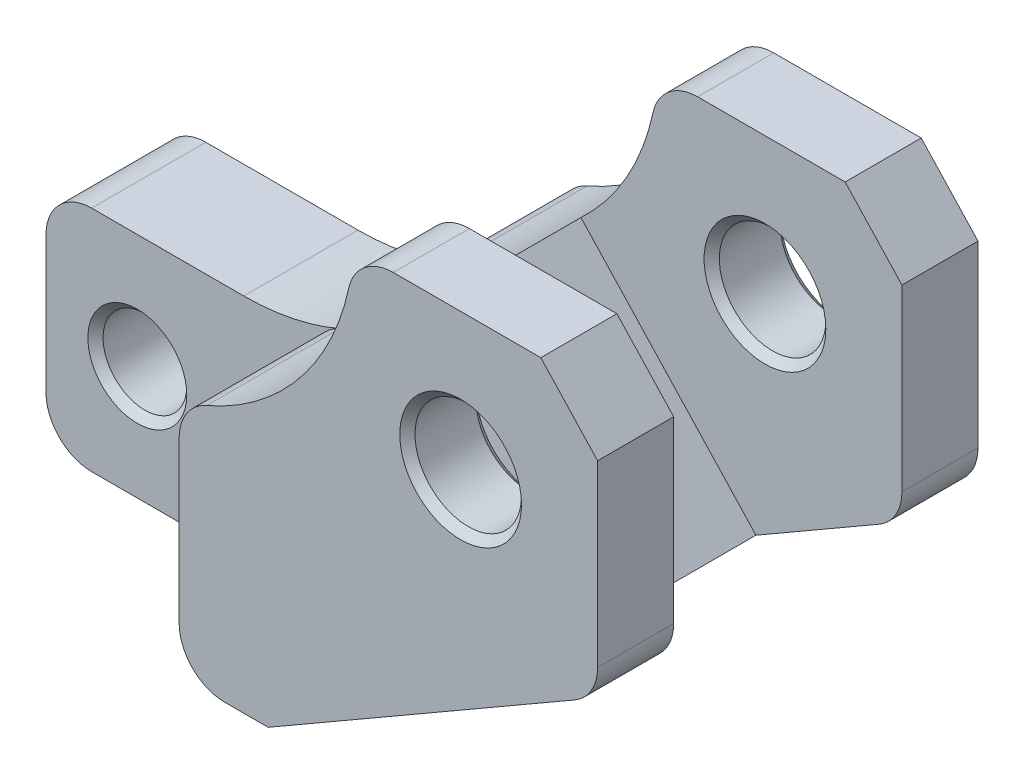
from build123d import *

# Parameters (mm, degrees)
BOSS_EXTRUDE1_DEPTH     = 25000
CHAMFER1_SIZE           = 8000
CHAMFER1_SIZE2          = 7460.120689101317
CUT_EXTRUDE1_DEPTH      = 15000
CUT_EXTRUDE2_DEPTH      = 17500
FILLET1_R               = 6000
CUT_EXTRUDE3_DEPTH      = 112944.56998076734
CUT_EXTRUDE3_DEPTH_BACK = 112944.56998076734
SKETCH6_R               = 5500.000000000001
CUT_EXTRUDE4_DEPTH      = 119164.7528781319
CUT_EXTRUDE4_DEPTH_BACK = 119164.7528781319
SKETCH7_R               = 7000.000000000006
CHAMFER2_SIZE           = 1000
CHAMFER3_SIZE           = 1000
FILLET2_R               = 6000


with BuildPart() as part:
    # Sketch1 → Boss-Extrude1 (new, symmetric)
    with BuildSketch(Plane.XY):
        with BuildLine():
            Line((-6.7599e-13, 23999.999999999956), (-1.69e-13, 6000.000000000043))
            ThreePointArc((-1.69e-13, 6000.000000000043), (1757.3593128807133, 1757.3593128807152), (6000.000000000043, 0))
            Line((6000.000000000043, 0), (46698.72981077821, 0))
            Line((46698.72981077821, 0), (86999.99999999999, 23267.949192431108))
            ThreePointArc((86999.99999999999, 23267.949192431108), (89196.15242270664, 25464.101615137755), (90000, 28464.101615137777))
            Line((90000, 28464.101615137777), (90000, 60000))
            Line((90000, 60000), (63148.35124201342, 59999.99999999999))
            ThreePointArc((63148.35124201342, 59999.99999999999), (59378.66606738816, 58667.919631292985), (57282.82209853761, 55263.15789473683))
            ThreePointArc((57282.82209853761, 55263.15789473683), (46104.987598001375, 37104.42863310402), (25999.999999999993, 30000))
            Line((25999.999999999993, 30000), (6000.000000000042, 30000))
            ThreePointArc((6000.000000000042, 30000), (1757.3593128807124, 28242.640687119285), (-6.7599e-13, 23999.999999999956))
        make_face()
    extrude(amount=BOSS_EXTRUDE1_DEPTH, both=True)

    # Chamfer1
    chamfer1_edges = [part.edges().sort_by_distance(p)[0] for p in [
        (90000, 60000, 0),
    ]]
    chamfer1_side = [part.faces().sort_by_distance(p)[0] for p in [
        (90000, 44232.050807568885, -1.1813e-13),
    ]]
    chamfer(chamfer1_edges, length=CHAMFER1_SIZE, length2=CHAMFER1_SIZE2, reference=chamfer1_side[0])

    # Sketch4 → Cut-Extrude1 (cut, symmetric)
    with BuildSketch(Plane.XY):
        with BuildLine():
            Line((70814.20664708655, 13923.077043078853), (47814.18446750665, 38587.581158334135))
            ThreePointArc((47814.18446750665, 38587.581158334135), (53826.99662991948, 46199.4222080821), (57282.82209853761, 55263.15789473681))
            ThreePointArc((57282.82209853761, 55263.15789473681), (59378.66606738815, 58667.919631292985), (63148.35124201342, 60000))
            Line((63148.35124201342, 60000), (82539.87931089872, 60000))
            Line((82539.87931089872, 60000), (90000, 51999.99999999997))
            Line((90000, 51999.99999999997), (90000, 28464.101615137777))
            ThreePointArc((90000, 28464.101615137777), (89196.15242270664, 25464.101615137755), (86999.99999999999, 23267.949192431108))
            Line((86999.99999999999, 23267.949192431108), (70814.20664708655, 13923.077043078853))
        make_face()
    extrude(amount=CUT_EXTRUDE1_DEPTH, both=True, mode=Mode.SUBTRACT)

    # Sketch5 → Cut-Extrude2 (cut)
    with BuildSketch(Plane.XY.offset(25000)):
        with BuildLine():
            Line((35000, 0), (35000, 31291.694934431827))
            ThreePointArc((35000, 31291.694934431827), (30546.11031002429, 30324.56975747463), (25999.99999999999, 30000))
            Line((25999.99999999999, 30000), (6000.000000000041, 30000))
            ThreePointArc((6000.000000000041, 30000), (1757.3593128807133, 28242.640687119285), (-1.77636e-12, 23999.999999999956))
            Line((-1.77636e-12, 23999.999999999956), (0, 6000.000000000043))
            ThreePointArc((0, 6000.000000000043), (1757.3593128807133, 1757.3593128807152), (6000.000000000041, 0))
            Line((6000.000000000041, 0), (35000, 0))
        make_face()
    cut_extrude2 = extrude(amount=-CUT_EXTRUDE2_DEPTH, mode=Mode.SUBTRACT)

    # Mirror2: Cut-Extrude2 across plane
    add(cut_extrude2.mirror(Plane.XY), mode=Mode.SUBTRACT)

    # Fillet1
    fillet1_edges = [part.edges().sort_by_distance(p)[0] for p in [
        (35000, 0, 16250),
        (35000, 31291.694934431827, 16250),
    ]]
    fillet(fillet1_edges, radius=FILLET1_R)

    # Sketch6 → Cut-Extrude3 (cut, two sides: drawn at the far end of the back side and taken through both)
    with BuildSketch(Plane.XY.offset(7500).offset(-CUT_EXTRUDE3_DEPTH_BACK)):
        with Locations((11999.999999999998, 15000)):
            Circle(SKETCH6_R)
    extrude(amount=CUT_EXTRUDE3_DEPTH + CUT_EXTRUDE3_DEPTH_BACK, mode=Mode.SUBTRACT)

    # Sketch7 → Cut-Extrude4 (cut, two sides: drawn at the far end of the back side and taken through both)
    with BuildSketch(Plane.XY.offset(25000).offset(-CUT_EXTRUDE4_DEPTH_BACK)):
        with Locations((72000, 42000)):
            Circle(SKETCH7_R)
    extrude(amount=CUT_EXTRUDE4_DEPTH + CUT_EXTRUDE4_DEPTH_BACK, mode=Mode.SUBTRACT)

    # Chamfer2
    chamfer2_edges = [part.edges().sort_by_distance(p)[0] for p in [
        (6499.999999999997, 15000, 7500),
        (64999.99999999999, 42000, 25000),
        (64999.99999999999, 42000, 15000),
    ]]
    chamfer(chamfer2_edges, length=CHAMFER2_SIZE)

    # Chamfer3
    chamfer3_edges = [part.edges().sort_by_distance(p)[0] for p in [
        (6499.999999999997, 15000, -7500),
        (64999.99999999999, 42000, -15000),
        (64999.99999999999, 42000, -25000),
    ]]
    chamfer(chamfer3_edges, length=CHAMFER3_SIZE)

    # Fillet2
    fillet2_edges = [part.edges().sort_by_distance(p)[0] for p in [
        (35000, 0, -16250),
        (35000, 31291.694934431827, -16250),
    ]]
    fillet(fillet2_edges, radius=FILLET2_R)


solid = part.part
